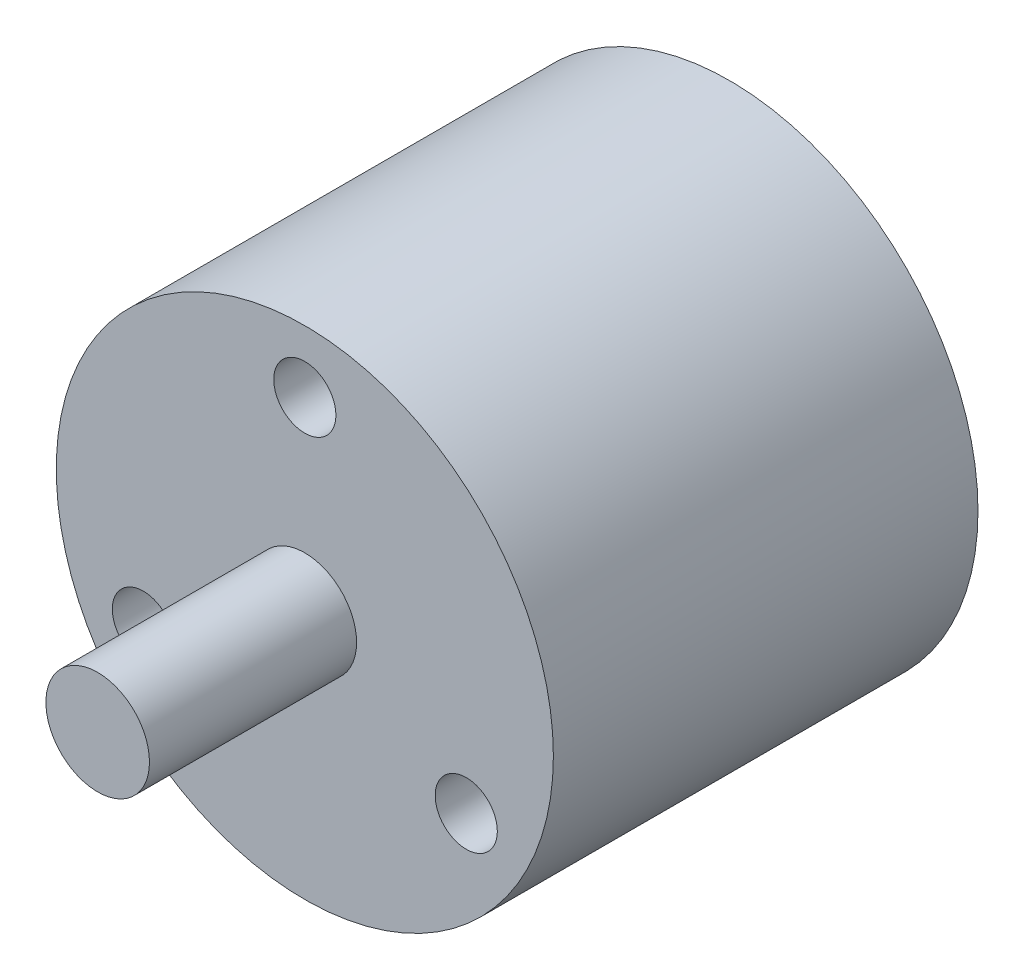
from build123d import *

# Parameters (mm, degrees)
ESQUISSE1_R             = 12
BOSS_EXTRU_1_DEPTH      = 20.5
ESQUISSE2_R             = 2.5
BOSS_EXTRU_2_DEPTH      = 2
ESQUISSE3_R             = 1.5
ENL_V_MAT_EXTRU_1_DEPTH = 3
ESQUISSE4_R             = 2.5
BOSS_EXTRU_3_DEPTH      = 8


with BuildPart() as part:
    # Esquisse1 → Boss.-Extru.1 (new body)
    with BuildSketch(Plane.XY):
        Circle(ESQUISSE1_R)
    extrude(amount=BOSS_EXTRU_1_DEPTH)

    # Esquisse2 → Boss.-Extru.2 (add)
    with BuildSketch(Plane.XY.offset(20.5)):
        Circle(ESQUISSE2_R)
    extrude(amount=BOSS_EXTRU_2_DEPTH)

    # Esquisse3 → Enlèv. mat.-Extru.1 (cut)
    with BuildSketch(Plane.XY.offset(20.5)):
        with Locations((0, 9)):
            Circle(ESQUISSE3_R)
        with Locations((-7.794228634, -4.5)):
            Circle(ESQUISSE3_R)
        with Locations((7.794228634, -4.5)):
            Circle(ESQUISSE3_R)
    extrude(amount=-ENL_V_MAT_EXTRU_1_DEPTH, mode=Mode.SUBTRACT)

    # Esquisse4 → Boss.-Extru.3 (add)
    with BuildSketch(Plane.XY.offset(22.5)):
        Circle(ESQUISSE4_R)
    extrude(amount=BOSS_EXTRU_3_DEPTH)


solid = part.part
